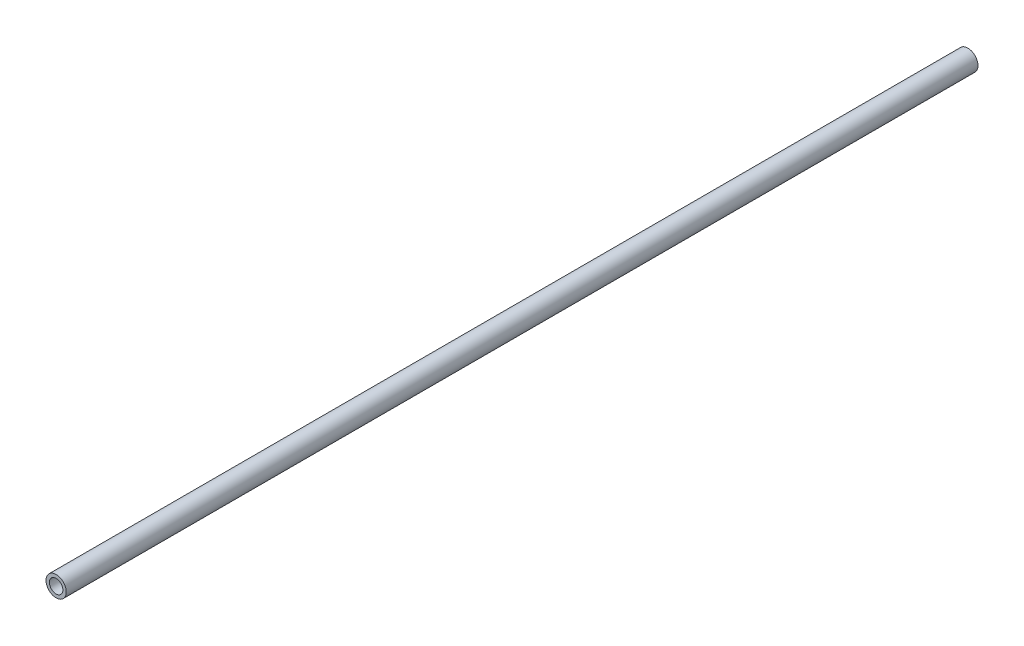
from build123d import *

# Parameters (mm, degrees)
SKETCH1_R           = 3
SKETCH1_R_2         = 2
BOSS_EXTRUDE1_DEPTH = 270


with BuildPart() as part:
    # Sketch1 → Boss-Extrude1 (new body)
    with BuildSketch(Plane.XY):
        Circle(SKETCH1_R)
        Circle(SKETCH1_R_2, mode=Mode.SUBTRACT)
    extrude(amount=BOSS_EXTRUDE1_DEPTH)


solid = part.part
